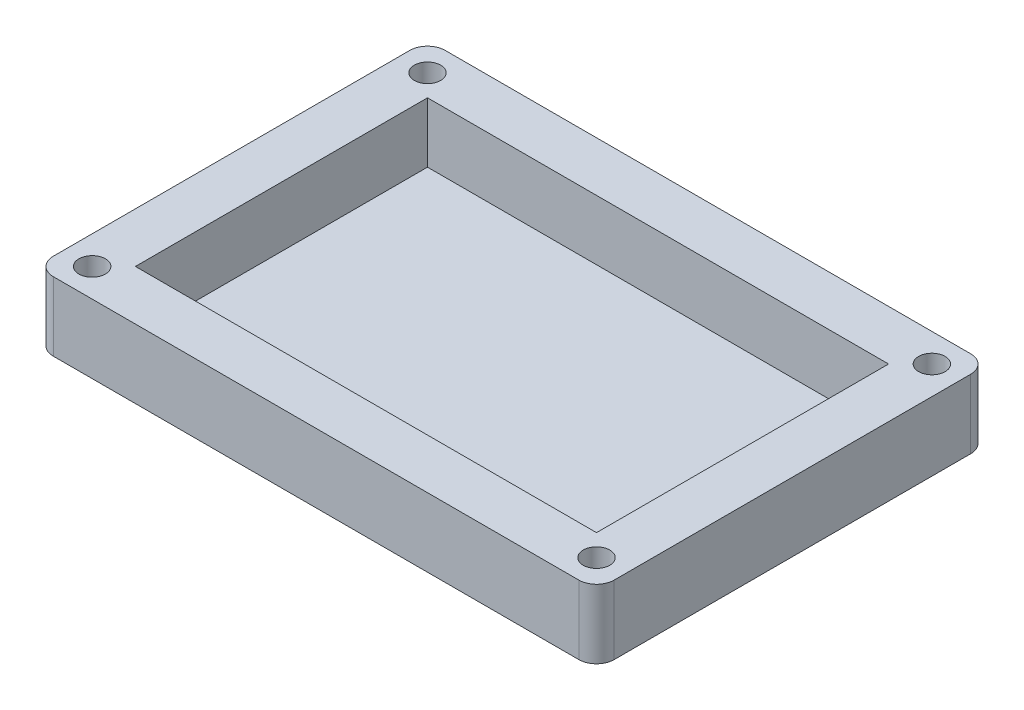
from build123d import *

# Parameters (mm, degrees)
SKETCH1_W           = 63.5
SKETCH1_H           = 44.36533334
BOSS_EXTRUDE1_DEPTH = 7.8
SKETCH2_W           = 52.20000001
SKETCH2_H           = 33.06533334
CUT_EXTRUDE1_DEPTH  = 6.8
SKETCH3_R           = 1.5
SKETCH3_R_2         = 1.50000001
CUT_EXTRUDE2_DEPTH  = 7.5
FILLET1_R           = 2


with BuildPart() as part:
    # Sketch1 → Boss-Extrude1 (new body)
    with BuildSketch(Plane(origin=(0, 0, 0), x_dir=(1, 0, 0), z_dir=(0, 1, 0))):
        with Locations((31.75, 22.18266667)):
            Rectangle(SKETCH1_W, SKETCH1_H)
    extrude(amount=BOSS_EXTRUDE1_DEPTH)

    # Sketch2 → Cut-Extrude1 (cut)
    with BuildSketch(Plane(origin=(0, 7.8, 0), x_dir=(1, 0, 0), z_dir=(0, 1, 0))):
        with Locations((31.750000005, 22.18266667)):
            Rectangle(SKETCH2_W, SKETCH2_H)
    extrude(amount=-CUT_EXTRUDE1_DEPTH, mode=Mode.SUBTRACT)

    # Sketch3 → Cut-Extrude2 (cut)
    with BuildSketch(Plane(origin=(0, 7.8, 0), x_dir=(1, 0, 0), z_dir=(0, 1, 0))):
        with Locations(Location((3.2, 3.2, 0), (0, 0, 270))):
            Circle(SKETCH3_R)
        with Locations(Location((3.2, 41.16533334, 0), (0, 0, 270))):
            Circle(SKETCH3_R)
        with Locations(Location((60.3, 41.16533334, 0), (0, 0, 270))):
            Circle(SKETCH3_R_2)
        with Locations(Location((60.3, 3.2, 0), (0, 0, 270))):
            Circle(SKETCH3_R_2)
    extrude(amount=-CUT_EXTRUDE2_DEPTH, mode=Mode.SUBTRACT)

    # Fillet1
    fillet1_edges = [part.edges().sort_by_distance(p)[0] for p in [
        (0, 3.9, -44.36533334),
        (63.5, 3.9, -44.36533334),
        (63.5, 3.9, 0),
        (0, 3.9, 0),
    ]]
    fillet(fillet1_edges, radius=FILLET1_R)


solid = part.part
